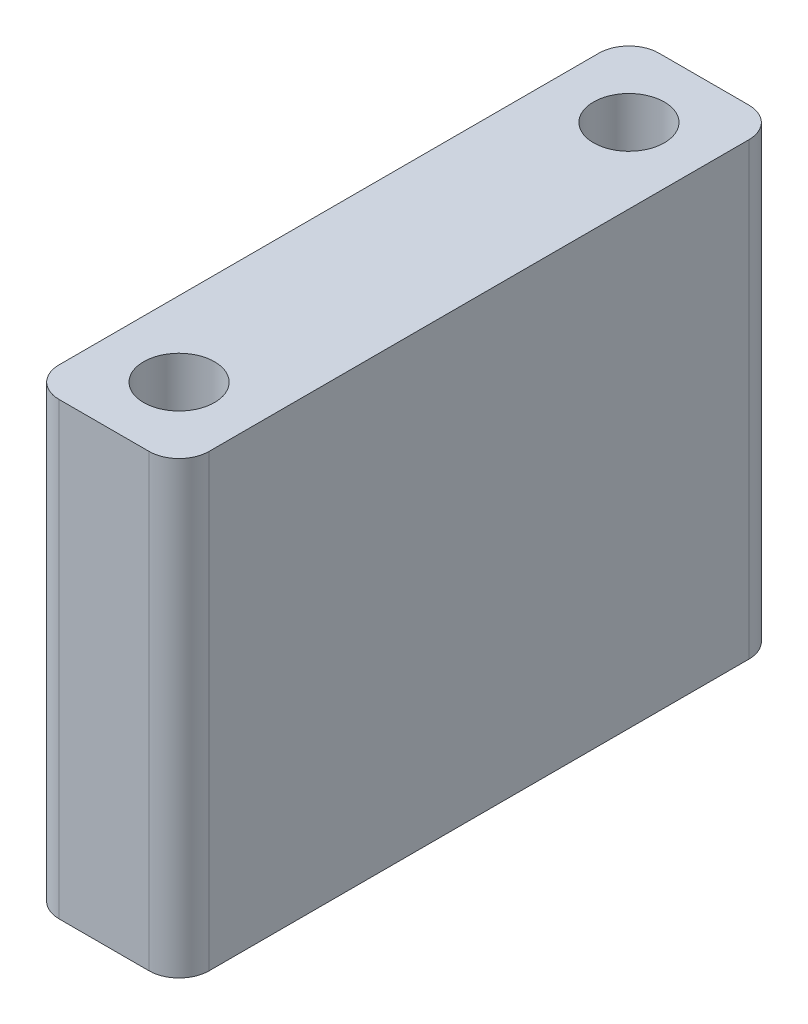
from build123d import *

# Parameters (mm, degrees)
SKETCH2_R           = 2.05
BOSS_EXTRUDE1_DEPTH = 38.1
SKETCH3_R           = 3
CUT_EXTRUDE1_DEPTH  = 50


with BuildPart() as part:
    # Sketch2 → Boss-Extrude1 (new body)
    with BuildSketch(Plane(origin=(0, 0, 0), x_dir=(1, 0, 0), z_dir=(0, 1, 0))):
        with BuildLine():
            ThreePointArc((-25.4, -22.86), (-24.656051224, -24.656051224), (-22.86, -25.4))
            Line((-22.86, -25.4), (-15.24, -25.4))
            ThreePointArc((-15.24, -25.4), (-13.443948776, -24.656051224), (-12.7, -22.86))
            Line((-12.7, -22.86), (-12.7, 22.86))
            ThreePointArc((-12.7, 22.86), (-13.443948776, 24.656051224), (-15.24, 25.4))
            Line((-15.24, 25.4), (-19.05, 25.4))
            Line((-19.05, 25.4), (-22.86, 25.4))
            ThreePointArc((-22.86, 25.4), (-24.656051224, 24.656051224), (-25.4, 22.86))
            Line((-25.4, 22.86), (-25.4, 19.05))
            Line((-25.4, 19.05), (-25.4, -22.86))
        make_face()
        with Locations(Location((-19.05, -19.05, 0), (0, 0, 90))):
            Circle(SKETCH2_R, mode=Mode.SUBTRACT)
        with Locations(Location((-19.05, 19.05, 0), (0, 0, 90))):
            Circle(SKETCH2_R, mode=Mode.SUBTRACT)
    extrude(amount=BOSS_EXTRUDE1_DEPTH)

    # Sketch3 → Cut-Extrude1 (cut)
    with BuildSketch(Plane(origin=(0, 38.1, 0), x_dir=(1, 0, 0), z_dir=(0, 1, 0))):
        with Locations(Location((-19.05, 19.05, 0), (0, 0, 270))):
            Circle(SKETCH3_R)
        with Locations(Location((-19.05, -19.05, 0), (0, 0, 270))):
            Circle(SKETCH3_R)
    extrude(amount=-CUT_EXTRUDE1_DEPTH, mode=Mode.SUBTRACT)


solid = part.part
